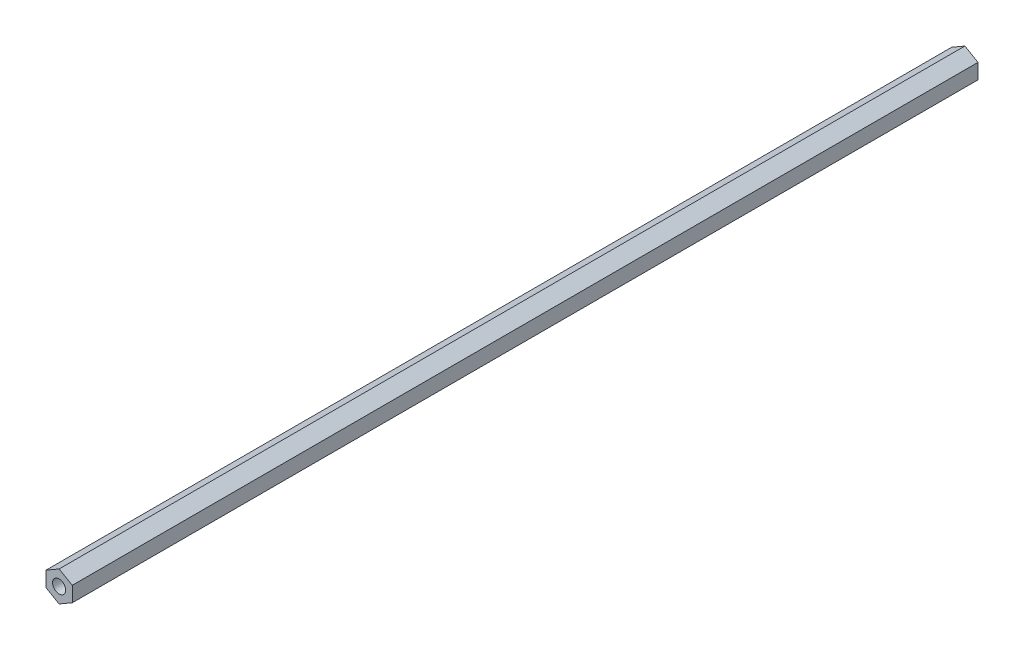
from build123d import *

# Parameters (mm, degrees)
BOSS_EXTRUDE2_DEPTH             = 219.075001
BOSS_EXTRUDE2_DEPTH_BACK        = 219.075001
F_1_4_0_25_DIAMETER_HOLE1_D     = 6.35
F_1_4_0_25_DIAMETER_HOLE1_DEPTH = 25.4
F_1_4_0_25_DIAMETER_HOLE1_TIP   = 1.907732465
F_1_4_0_25_DIAMETER_HOLE2_D     = 6.35
F_1_4_0_25_DIAMETER_HOLE2_DEPTH = 25.4
F_1_4_0_25_DIAMETER_HOLE2_TIP   = 1.907732465


with BuildPart() as part:
    # Sketch3 → Boss-Extrude2 (new, two sides: drawn at the far end of the back side and taken through both)
    with BuildSketch(Plane.XY.offset(-BOSS_EXTRUDE2_DEPTH_BACK)):
        Polygon((-6.35, -3.666174209), (0, -7.332348419), (6.35, -3.666174209), (6.35, 3.666174209), (0, 7.332348419), (-6.35, 3.666174209), align=None)
    extrude(amount=BOSS_EXTRUDE2_DEPTH + BOSS_EXTRUDE2_DEPTH_BACK)

    # 1/4 (0.25) Diameter Hole1
    with Locations(Plane.XY.offset(219.075000508)):
        with Locations((0, 0)):
            Hole(F_1_4_0_25_DIAMETER_HOLE1_D / 2, depth=F_1_4_0_25_DIAMETER_HOLE1_DEPTH)
            with Locations((0, 0, -(F_1_4_0_25_DIAMETER_HOLE1_DEPTH + F_1_4_0_25_DIAMETER_HOLE1_TIP / 2))):  # 118° drill point
                Cone(0, F_1_4_0_25_DIAMETER_HOLE1_D / 2, F_1_4_0_25_DIAMETER_HOLE1_TIP, mode=Mode.SUBTRACT)

    # 1/4 (0.25) Diameter Hole2
    with Locations(Plane(origin=(0, 0, -219.075000508), x_dir=(-1, 0, 0), z_dir=(0, 0, -1))):
        with Locations((0, 0)):
            Hole(F_1_4_0_25_DIAMETER_HOLE2_D / 2, depth=F_1_4_0_25_DIAMETER_HOLE2_DEPTH)
            with Locations((0, 0, -(F_1_4_0_25_DIAMETER_HOLE2_DEPTH + F_1_4_0_25_DIAMETER_HOLE2_TIP / 2))):  # 118° drill point
                Cone(0, F_1_4_0_25_DIAMETER_HOLE2_D / 2, F_1_4_0_25_DIAMETER_HOLE2_TIP, mode=Mode.SUBTRACT)


solid = part.part
